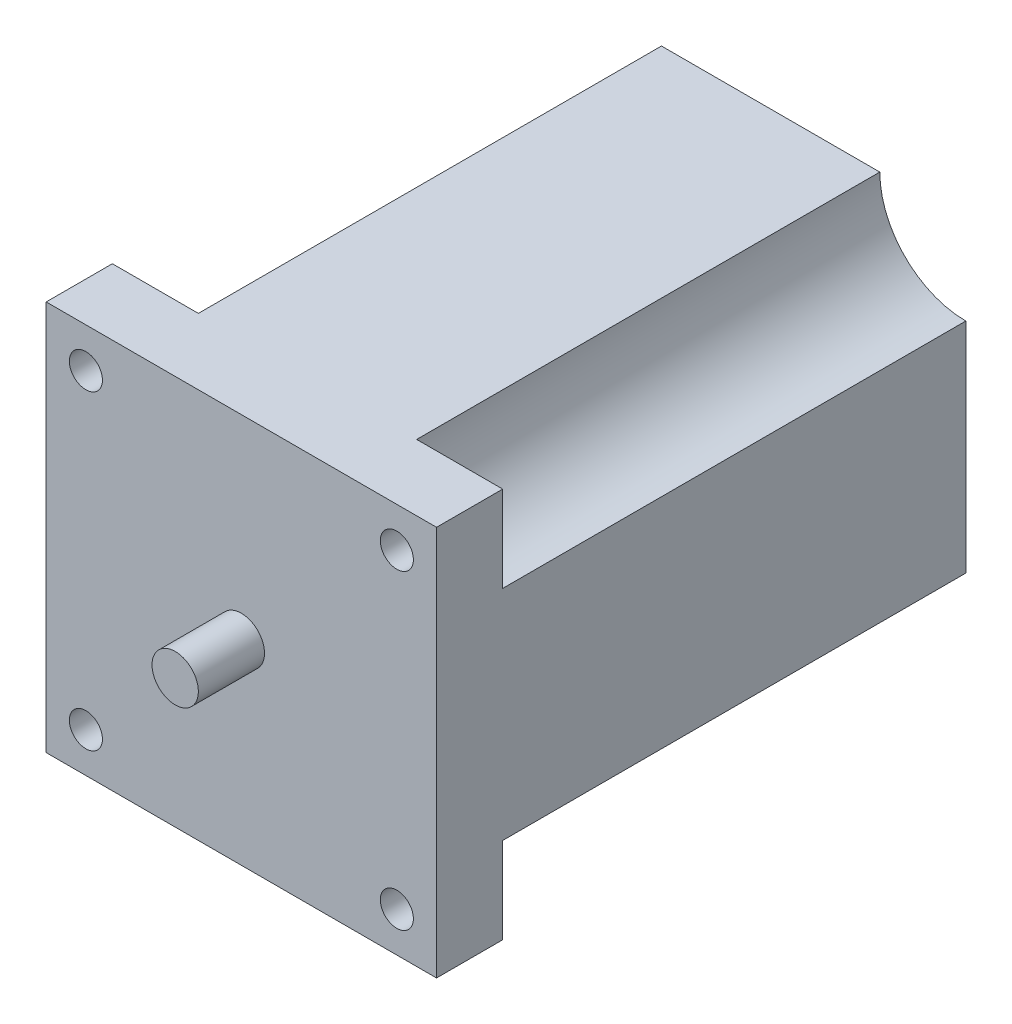
from build123d import *

# Parameters (mm, degrees)
SKETCH1_W           = 59
SKETCH1_H           = 59
BOSS_EXTRUDE1_DEPTH = 10
SKETCH2_R           = 2.5
CUT_EXTRUDE2_DEPTH  = 43.901048938
SKETCH4_R           = 3.5
BOSS_EXTRUDE2_DEPTH = 10
BOSS_EXTRUDE3_DEPTH = 70


with BuildPart() as part:
    # Sketch1 → Boss-Extrude1 (new body)
    with BuildSketch(Plane.XY):
        Rectangle(SKETCH1_W, SKETCH1_H)
    extrude(amount=BOSS_EXTRUDE1_DEPTH)

    # Sketch2 → Cut-Extrude2 (cut, through all)
    with BuildSketch(Plane.XY.offset(10)):
        with Locations((23.5, 23.5)):
            Circle(SKETCH2_R)
        with Locations((23.5, -23.5)):
            Circle(SKETCH2_R)
        with Locations((-23.5, -23.5)):
            Circle(SKETCH2_R)
        with Locations((-23.5, 23.5)):
            Circle(SKETCH2_R)
    extrude(amount=-CUT_EXTRUDE2_DEPTH, mode=Mode.SUBTRACT)

    # Sketch4 → Boss-Extrude2 (add)
    with BuildSketch(Plane.XY.offset(10)):
        with Locations(Location((0, 0, 0), (0, 0, 180))):
            Circle(SKETCH4_R)
    extrude(amount=BOSS_EXTRUDE2_DEPTH)

    # Sketch5 → Boss-Extrude3 (add)
    with BuildSketch(Plane(origin=(0, 0, 0), x_dir=(-1, 0, 0), z_dir=(0, 0, -1))):
        with BuildLine():
            Line((-29.5, 16.5), (-29.5, -16.5))
            ThreePointArc((-29.5, -16.5), (-20.307611845, -20.307611845), (-16.5, -29.5))
            Line((-16.5, -29.5), (16.5, -29.5))
            ThreePointArc((16.5, -29.5), (20.307611845, -20.307611845), (29.5, -16.5))
            Line((29.5, -16.5), (29.5, 16.5))
            ThreePointArc((29.5, 16.5), (20.307611845, 20.307611845), (16.5, 29.5))
            Line((16.5, 29.5), (-16.5, 29.5))
            ThreePointArc((-16.5, 29.5), (-20.307611845, 20.307611845), (-29.5, 16.5))
        make_face()
    extrude(amount=BOSS_EXTRUDE3_DEPTH)


solid = part.part
